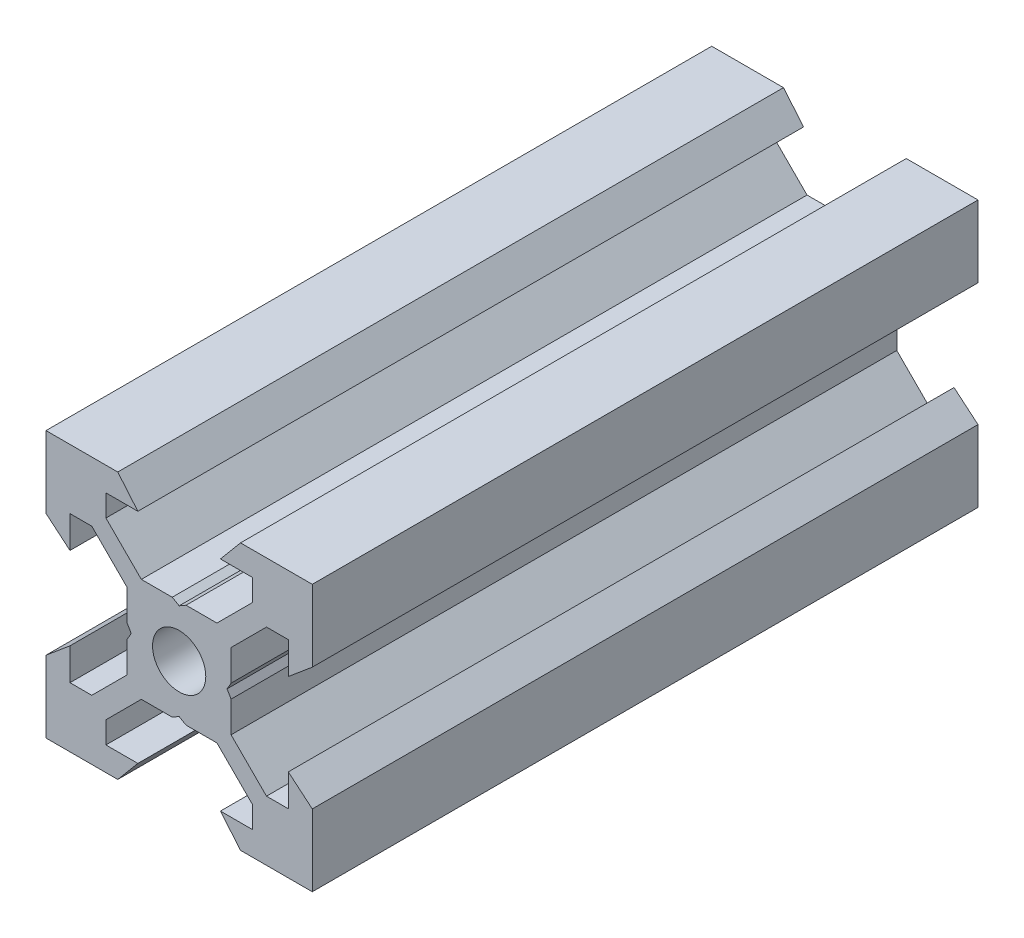
from build123d import *

# Parameters (mm, degrees)
SKETCH1_R           = 2
BOSS_EXTRUDE1_DEPTH = 25


with BuildPart() as part:
    # Sketch1 → Boss-Extrude1 (new, symmetric)
    with BuildSketch(Plane.XY):
        Polygon((10, 10), (10, 4.610379336), (8.2, 3.1), (8.2, 5.5), (6.560660172, 5.5), (3.9, 2.839339828), (3.9, 0.519615242), (3.6, 0), (3.9, -0.519615242), (3.9, -2.839339828), (6.560660172, -5.5), (8.2, -5.5), (8.2, -3.1), (10, -4.610379336), (10, -10), (4.610379336, -10), (3.1, -8.2), (5.5, -8.2), (5.5, -6.560660172), (2.839339828, -3.9), (0.519615242, -3.9), (0, -3.6), (-0.519615242, -3.9), (-2.839339828, -3.9), (-5.5, -6.560660172), (-5.5, -8.2), (-3.1, -8.2), (-4.610379336, -10), (-10, -10), (-10, -4.610379336), (-8.2, -3.1), (-8.2, -5.5), (-6.560660172, -5.5), (-3.9, -2.839339828), (-3.9, -0.519615242), (-3.6, 0), (-3.9, 0.519615242), (-3.9, 2.839339828), (-6.560660172, 5.5), (-8.2, 5.5), (-8.2, 3.1), (-10, 4.610379336), (-10, 10), (-4.610379336, 10), (-3.1, 8.2), (-5.5, 8.2), (-5.5, 6.560660172), (-2.839339828, 3.9), (-0.519615242, 3.9), (0, 3.6), (0.519615242, 3.9), (2.839339828, 3.9), (5.5, 6.560660172), (5.5, 8.2), (3.1, 8.2), (4.610379336, 10), align=None)
        Circle(SKETCH1_R, mode=Mode.SUBTRACT)
    extrude(amount=BOSS_EXTRUDE1_DEPTH, both=True)


solid = part.part
